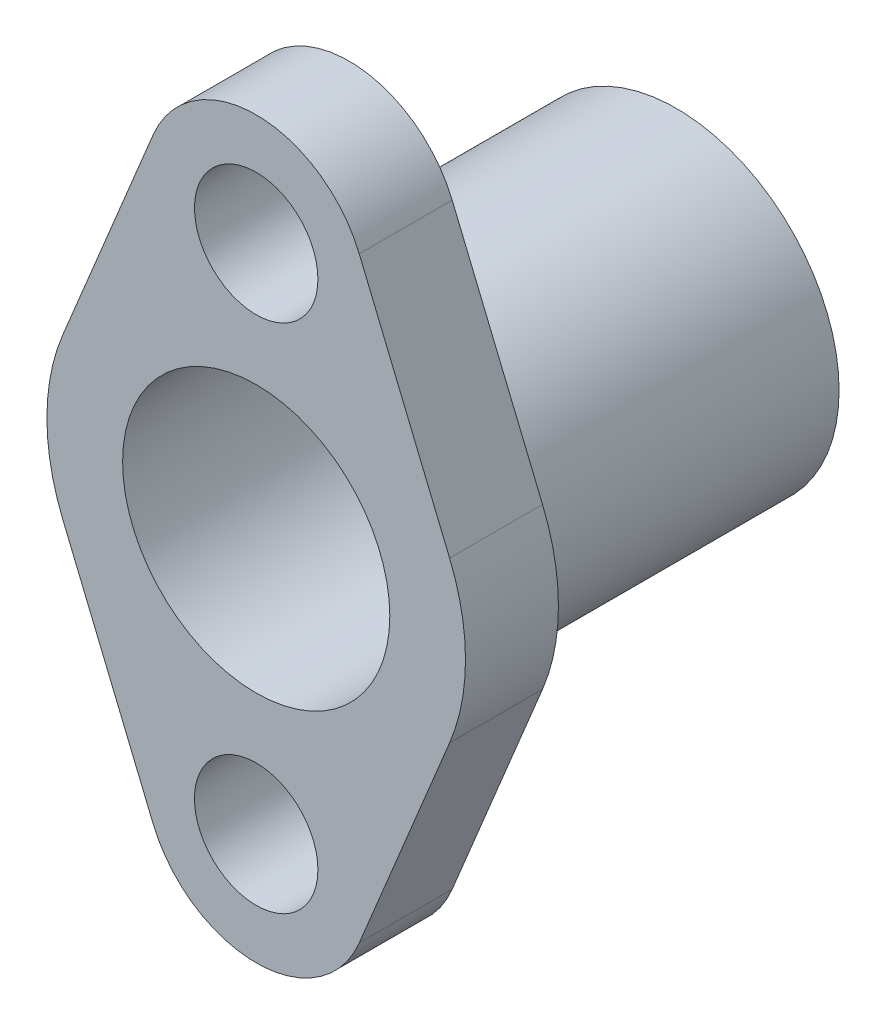
from build123d import *

# Parameters (mm, degrees)
SKETCH2_OUTSIDE_W  = 35.136
SKETCH2_OUTSIDE_H  = 35.136
SKETCH2_OUTSIDE_R  = 2.1082
CUT_EXTRUDE1_DEPTH = 22.020706078


with BuildPart() as part:
    # Sketch1 → Revolve1 (revolve)
    with BuildSketch(Plane(origin=(0, 0, 0), x_dir=(0, 0, -1), z_dir=(1, 0, 0)), mode=Mode.PRIVATE) as revolve1_sk:
        Polygon((-0.254, 5.5626), (10.922, 5.5626), (10.922, 4.24942), (9.906, 4.24942), (9.724157759, 4.56438), (-3.429, 4.56438), (-3.429, 12.7), (-0.254, 12.7), align=None)
    revolve(revolve1_sk.sketch.rotate(Axis((0, 0, -8.471806123), (0, 0, -1)), 90), axis=Axis((0, 0, -8.471806123), (0, 0, -1)))

    # Sketch2 outside → Cut-Extrude1 (cut, through all)
    # profile 1 of 3: a face of its own
    with BuildSketch(Plane.XY):
        Rectangle(SKETCH2_OUTSIDE_W, SKETCH2_OUTSIDE_H)
        with BuildLine():
            Line((6.607062287, 2.733250436), (3.520637098, 10.194038953))
            ThreePointArc((3.520637098, 10.194038953), (0, 12.5476), (-3.520637098, 10.194038953))
            Line((-3.520637098, 10.194038953), (-6.607062287, 2.733250436))
            ThreePointArc((-6.607062287, 2.733250436), (-7.1501, 0), (-6.607062287, -2.733250436))
            Line((-6.607062287, -2.733250436), (-3.520637098, -10.194038953))
            ThreePointArc((-3.520637098, -10.194038953), (0, -12.5476), (3.520637098, -10.194038953))
            Line((3.520637098, -10.194038953), (6.607062287, -2.733250436))
            ThreePointArc((6.607062287, -2.733250436), (7.1501, 0), (6.607062287, 2.733250436))
        make_face(mode=Mode.SUBTRACT)
    # profile 2 of 3: a face of its own
    with BuildSketch(Plane.XY):
        with Locations((0, 8.7376)):
            Circle(SKETCH2_OUTSIDE_R)
    # profile 3 of 3: a face of its own
    with BuildSketch(Plane.XY):
        with Locations((0, -8.7376)):
            Circle(SKETCH2_OUTSIDE_R)
    extrude(amount=CUT_EXTRUDE1_DEPTH, mode=Mode.SUBTRACT)


solid = part.part
